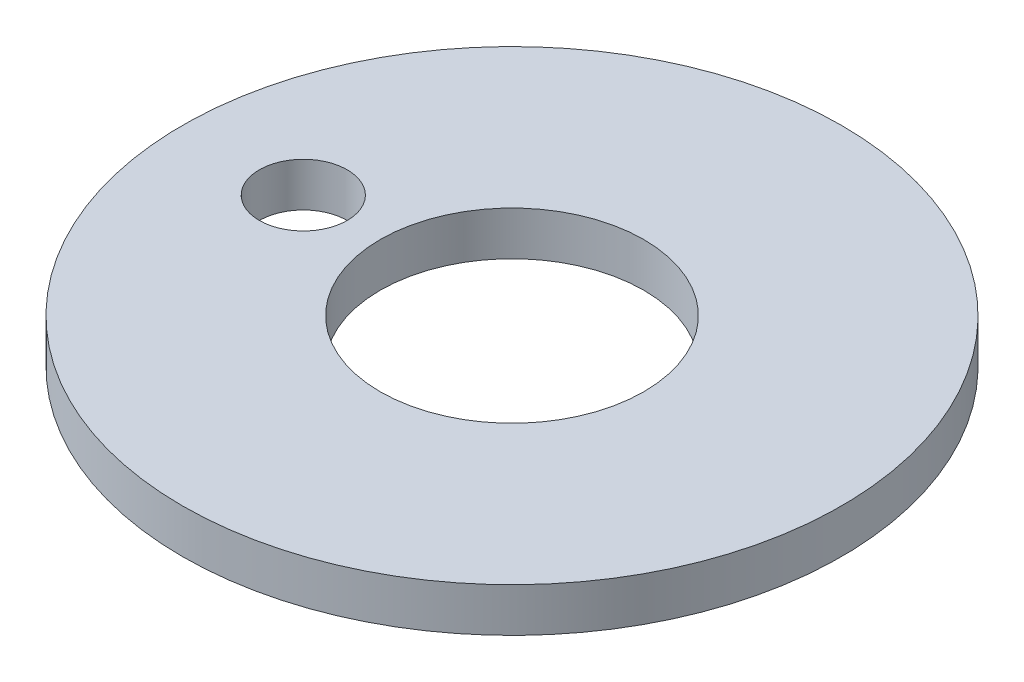
from build123d import *

# Parameters (mm, degrees)
SKETCH1_R           = 15
SKETCH1_R_2         = 2
SKETCH1_R_3         = 6
BOSS_EXTRUDE1_DEPTH = 2


with BuildPart() as part:
    # Sketch1 → Boss-Extrude1 (new body)
    with BuildSketch(Plane(origin=(0, 0, 0), x_dir=(1, 0, 0), z_dir=(0, 1, 0))):
        with Locations(Location((0, 0, 0), (0, 0, 270))):
            Circle(SKETCH1_R)
        with Locations(Location((-9.5, 0, 0), (0, 0, 270))):
            Circle(SKETCH1_R_2, mode=Mode.SUBTRACT)
        with Locations(Location((0, 0, 0), (0, 0, 270))):
            Circle(SKETCH1_R_3, mode=Mode.SUBTRACT)
    extrude(amount=BOSS_EXTRUDE1_DEPTH)


solid = part.part
